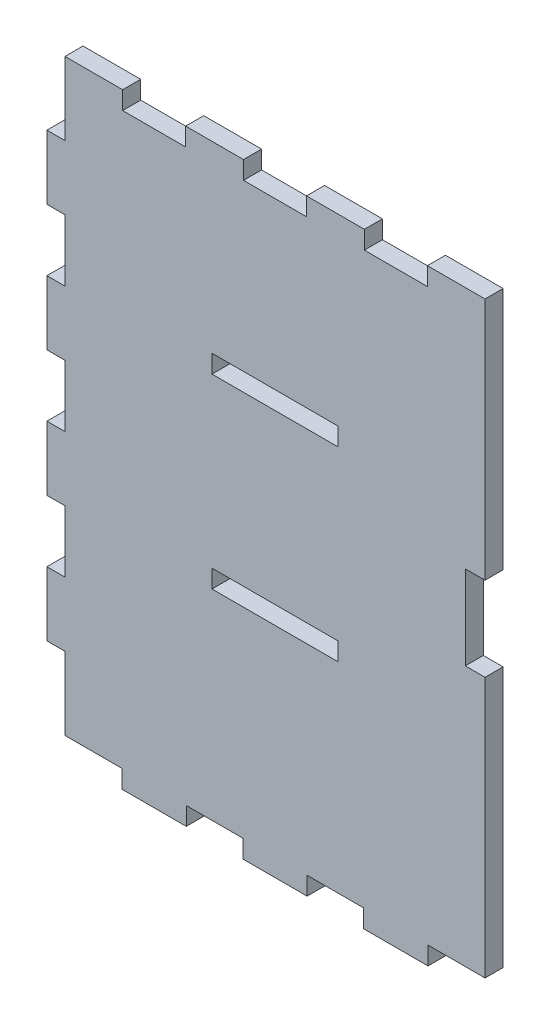
from build123d import *

# Parameters (mm, degrees)
SKETCH2_W           = 30
SKETCH2_H           = 4.3
BOSS_EXTRUDE1_DEPTH = 4.3


with BuildPart() as part:
    # Sketch2 → Boss-Extrude1 (new body)
    with BuildSketch(Plane.XY):
        Polygon((100, 140), (100, 82), (95.3, 82), (95.3, 62), (100, 62), (100, 0), (86.425, 0), (86.425, -4.3), (71.125, -4.3), (71.125, 0), (57.65, 0), (57.65, -4.3), (42.35, -4.3), (42.35, 0), (28.875, 0), (28.875, -4.3), (13.575, -4.3), (13.575, 0), (0, 0), (0, 17.35), (-4.3, 17.35), (-4.3, 32.65), (0, 32.65), (0, 47.35), (-4.3, 47.35), (-4.3, 62.65), (0, 62.65), (0, 77.35), (-4.3, 77.35), (-4.3, 92.65), (0, 92.65), (0, 107.35), (-4.3, 107.35), (-4.3, 122.65), (0, 122.65), (0, 140), (13.725, 140), (13.725, 135.7), (28.725, 135.7), (28.725, 140), (42.5, 140), (42.5, 135.7), (57.5, 135.7), (57.5, 140), (71.275, 140), (71.275, 135.7), (86.275, 135.7), (86.275, 140), align=None)
        with Locations((50, 49.85)):
            Rectangle(SKETCH2_W, SKETCH2_H, mode=Mode.SUBTRACT)
        with Locations((50, 94.15)):
            Rectangle(SKETCH2_W, SKETCH2_H, mode=Mode.SUBTRACT)
    extrude(amount=BOSS_EXTRUDE1_DEPTH)


solid = part.part
